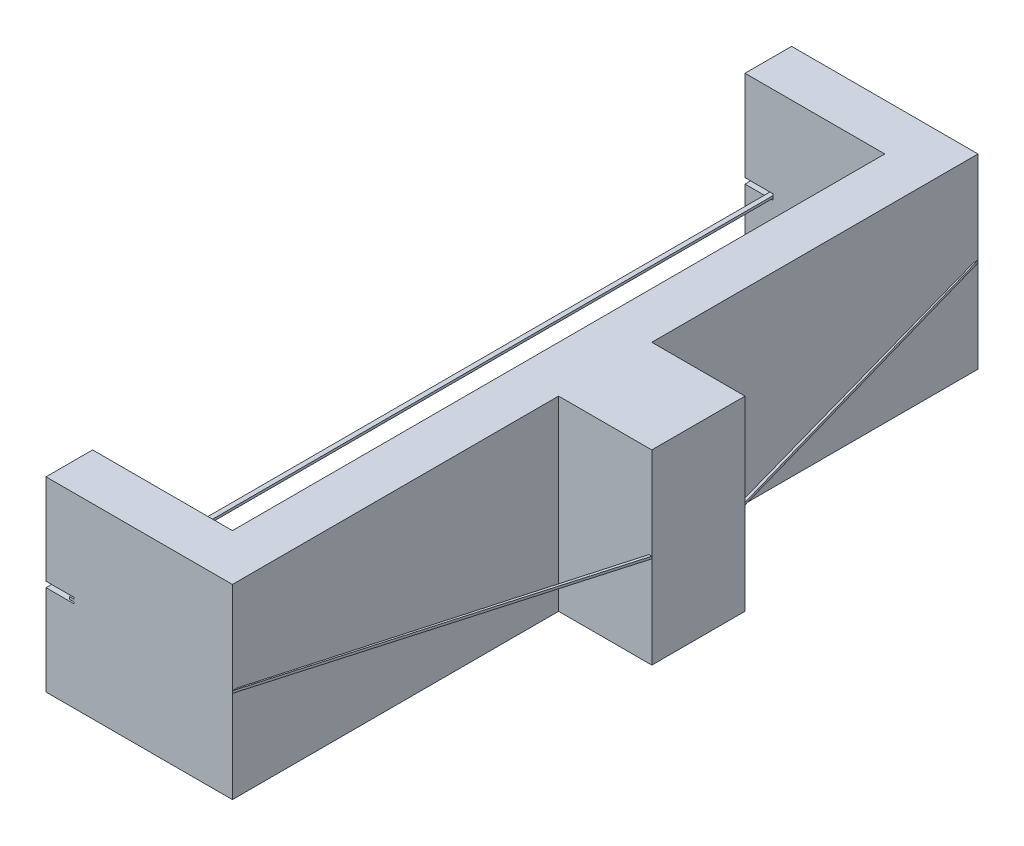
from build123d import *

# Parameters (mm, degrees)
ESQUISSE1_W             = 20
ESQUISSE1_H             = 20
BOSS_EXTRU_1_DEPTH      = 5
ESQUISSE2_W             = 5
ESQUISSE2_H             = 20
BOSS_EXTRU_2_DEPTH      = 70
ESQUISSE3_W             = 20
ESQUISSE3_H             = 20
BOSS_EXTRU_3_DEPTH      = 5
ESQUISSE4_W             = 3
ESQUISSE4_H             = 0.6
ENL_V_MAT_EXTRU_1_DEPTH = 90
ESQUISSE5_W             = 80
ESQUISSE5_H             = 0.25
BOSS_EXTRU_4_DEPTH      = 0.5
ESQUISSE8_W             = 10
ESQUISSE8_H             = 20
BOSS_EXTRU_6_DEPTH      = 10
BOSS_EXTRU_8_DEPTH      = 0.125
BOSS_EXTRU_8_DEPTH_BACK = 0.125


with BuildPart() as part:
    # Esquisse1 → Boss.-Extru.1 (new body)
    with BuildSketch(Plane.XY):
        Rectangle(ESQUISSE1_W, ESQUISSE1_H)
    extrude(amount=BOSS_EXTRU_1_DEPTH)

    # Esquisse2 → Boss.-Extru.2 (add)
    with BuildSketch(Plane.XY.offset(5)):
        with Locations((7.5, 0)):
            Rectangle(ESQUISSE2_W, ESQUISSE2_H)
    extrude(amount=BOSS_EXTRU_2_DEPTH)

    # Esquisse3 → Boss.-Extru.3 (add)
    with BuildSketch(Plane.XY.offset(75)):
        Rectangle(ESQUISSE3_W, ESQUISSE3_H)
    extrude(amount=BOSS_EXTRU_3_DEPTH)

    # Esquisse4 → Enlèv. mat.-Extru.1 (cut)
    with BuildSketch(Plane.XY.offset(80)):
        with Locations((-8.5, 0)):
            Rectangle(ESQUISSE4_W, ESQUISSE4_H)
    extrude(amount=-ENL_V_MAT_EXTRU_1_DEPTH, mode=Mode.SUBTRACT)

    # Esquisse5 → Boss.-Extru.4 (add)
    with BuildSketch(Plane.ZY.offset(7)):
        with Locations((40, 0)):
            Rectangle(ESQUISSE5_W, ESQUISSE5_H)
    extrude(amount=BOSS_EXTRU_4_DEPTH)

    # Esquisse8 → Boss.-Extru.6 (add)
    with BuildSketch(Plane(origin=(10, 0, 0), x_dir=(0, 0, -1), z_dir=(1, 0, 0))):
        with Locations((-40, 0)):
            Rectangle(ESQUISSE8_W, ESQUISSE8_H)
    extrude(amount=BOSS_EXTRU_6_DEPTH)

    # Esquisse10 → Boss.-Extru.8 (add, two sides: drawn at the far end of the back side and taken through both)
    with BuildSketch(Plane(origin=(0, 0, 0), x_dir=(1, 0, 0), z_dir=(0, 1, 0)).offset(-BOSS_EXTRU_8_DEPTH_BACK)):
        Polygon((10, -79.5), (19.7, -45), (20, -45), (10, -80), align=None)
        Polygon((19.7, -35), (20, -35), (10, 0), (10, -0.5), align=None)
    extrude(amount=BOSS_EXTRU_8_DEPTH + BOSS_EXTRU_8_DEPTH_BACK)


solid = part.part
